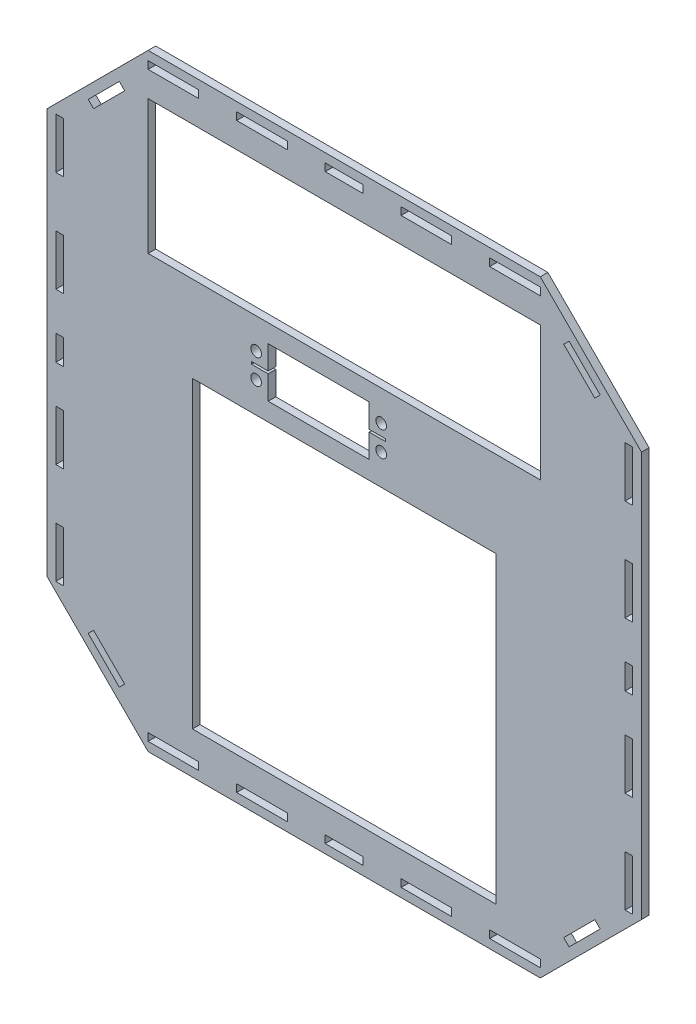
from build123d import *

# Parameters (mm, degrees)
SKICA2_R                = 2.1
SKICA2_W                = 3
SKICA2_H                = 20
SKICA2_H_2              = 10
SKICA2_W_2              = 20
SKICA2_H_3              = 3
SKICA2_W_3              = 15
SKICA2_W_4              = 155
SKICA2_H_4              = 53
SKICA2_W_5              = 120
SKICA2_H_5              = 120
P_IDAT_VYSUNUT_M1_DEPTH = 3


with BuildPart() as part:
    # Skica2 → Přidat vysunutím1 (new body)
    with BuildSketch(Plane.XY):
        Polygon((-117.5, 80), (-77.5, 120), (77.5, 120), (117.5, 80), (117.5, -80), (77.5, -120), (-77.5, -120), (-117.5, -80), align=None)
        with Locations((14.611145618, 38.425)):
            Circle(SKICA2_R, mode=Mode.SUBTRACT)
        with Locations((14.611145618, 28.575)):
            Circle(SKICA2_R, mode=Mode.SUBTRACT)
        with Locations((-34.811145618, 28.575)):
            Circle(SKICA2_R, mode=Mode.SUBTRACT)
        with Locations((-34.811145618, 38.425)):
            Circle(SKICA2_R, mode=Mode.SUBTRACT)
        with Locations((-112.5, 70)):
            Rectangle(SKICA2_W, SKICA2_H, mode=Mode.SUBTRACT)
        with Locations((-112.5, 30)):
            Rectangle(SKICA2_W, SKICA2_H, mode=Mode.SUBTRACT)
        with Locations((-112.5, 0)):
            Rectangle(SKICA2_W, SKICA2_H_2, mode=Mode.SUBTRACT)
        with Locations((-112.5, -30)):
            Rectangle(SKICA2_W, SKICA2_H, mode=Mode.SUBTRACT)
        with Locations((-112.5, -70)):
            Rectangle(SKICA2_W, SKICA2_H, mode=Mode.SUBTRACT)
        with Locations((112.5, -70)):
            Rectangle(SKICA2_W, SKICA2_H, mode=Mode.SUBTRACT)
        with Locations((112.5, -30)):
            Rectangle(SKICA2_W, SKICA2_H, mode=Mode.SUBTRACT)
        with Locations((112.5, 0)):
            Rectangle(SKICA2_W, SKICA2_H_2, mode=Mode.SUBTRACT)
        with Locations((112.5, 30)):
            Rectangle(SKICA2_W, SKICA2_H, mode=Mode.SUBTRACT)
        with Locations((112.5, 70)):
            Rectangle(SKICA2_W, SKICA2_H, mode=Mode.SUBTRACT)
        with Locations((-67.5, 115)):
            Rectangle(SKICA2_W_2, SKICA2_H_3, mode=Mode.SUBTRACT)
        with Locations((-32.5, 115)):
            Rectangle(SKICA2_W_2, SKICA2_H_3, mode=Mode.SUBTRACT)
        with Locations((0, 115)):
            Rectangle(SKICA2_W_3, SKICA2_H_3, mode=Mode.SUBTRACT)
        with Locations((32.5, 115)):
            Rectangle(SKICA2_W_2, SKICA2_H_3, mode=Mode.SUBTRACT)
        with Locations((67.5, 115)):
            Rectangle(SKICA2_W_2, SKICA2_H_3, mode=Mode.SUBTRACT)
        with Locations((67.5, -115)):
            Rectangle(SKICA2_W_2, SKICA2_H_3, mode=Mode.SUBTRACT)
        with Locations((32.5, -115)):
            Rectangle(SKICA2_W_2, SKICA2_H_3, mode=Mode.SUBTRACT)
        with Locations((0, -115)):
            Rectangle(SKICA2_W_3, SKICA2_H_3, mode=Mode.SUBTRACT)
        with Locations((-32.5, -115)):
            Rectangle(SKICA2_W_2, SKICA2_H_3, mode=Mode.SUBTRACT)
        with Locations((-67.5, -115)):
            Rectangle(SKICA2_W_2, SKICA2_H_3, mode=Mode.SUBTRACT)
        Polygon((101.168524548, -91.381727984), (88.881727984, -103.668524548), (86.76040764, -101.547204204), (99.047204204, -89.26040764), align=None, mode=Mode.SUBTRACT)
        Polygon((-86.76040764, -101.547204204), (-99.047204204, -89.26040764), (-101.168524548, -91.381727984), (-88.881727984, -103.668524548), align=None, mode=Mode.SUBTRACT)
        Polygon((86.76040764, 101.547204204), (99.047204204, 89.26040764), (101.168524548, 91.381727984), (88.881727984, 103.668524548), align=None, mode=Mode.SUBTRACT)
        Polygon((-88.881727984, 103.668524548), (-86.76040764, 101.547204204), (-99.047204204, 89.26040764), (-101.168524548, 91.381727984), align=None, mode=Mode.SUBTRACT)
        with Locations((0, 77)):
            Rectangle(SKICA2_W_4, SKICA2_H_4, mode=Mode.SUBTRACT)
        with Locations((0, -43.5)):
            Rectangle(SKICA2_W_5, SKICA2_H_5, mode=Mode.SUBTRACT)
        Polygon((-30.05, 43.35), (-30.05, 33.975), (-36.6, 33.975), (-36.6, 33.025), (-30.05, 33.025), (-30.05, 23.65), (9.85, 23.65), (9.85, 33.025), (16.4, 33.025), (16.4, 33.975), (9.85, 33.975), (9.85, 43.35), align=None, mode=Mode.SUBTRACT)
    extrude(amount=P_IDAT_VYSUNUT_M1_DEPTH)


solid = part.part
